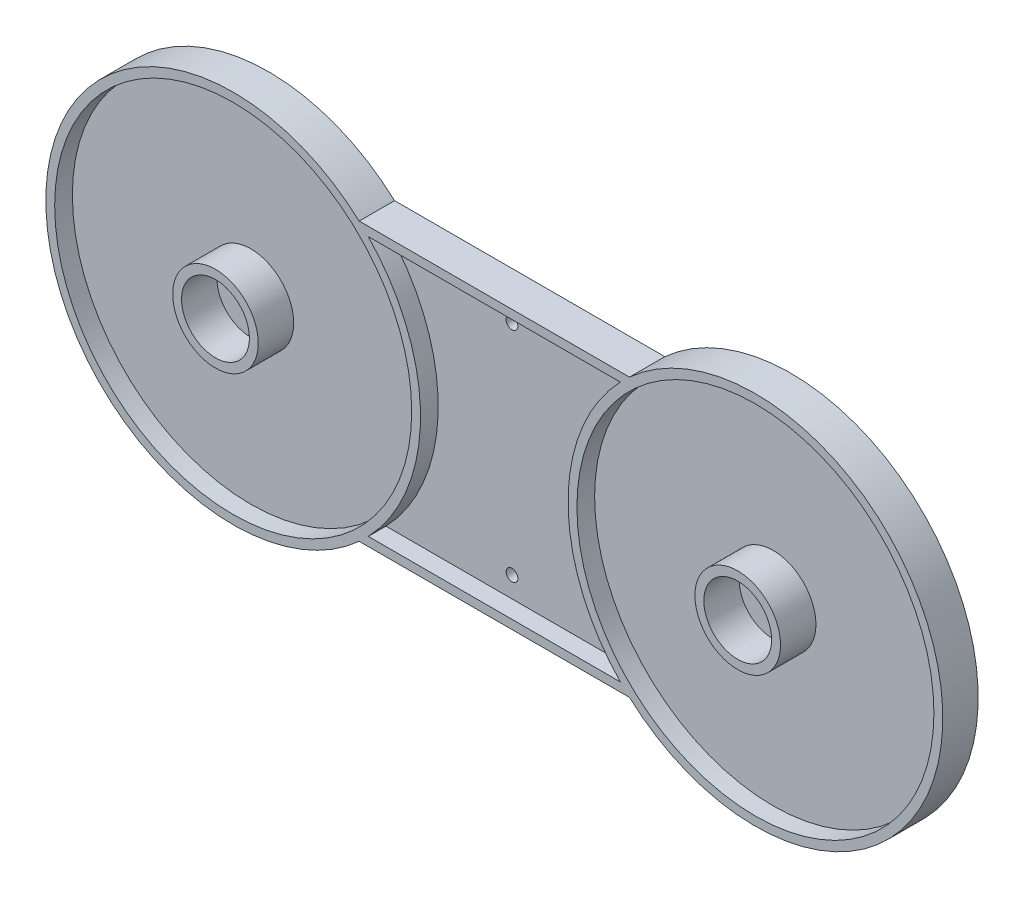
from build123d import *
from build123d.topology import SkipClean

# Parameters (mm, degrees)
IZIM2_R                     = 1
Y_KSEKLIK_EKSTR_ZYON1_DEPTH = 3
IZIM3_R                     = 30.25
Y_KSEKLIK_EKSTR_ZYON2_DEPTH = 3
IZIM4_R                     = 7.25
IZIM4_R_2                   = 5.75
Y_KSEKLIK_EKSTR_ZYON3_DEPTH = 6


with BuildPart() as part:
    # Çizim2 → Yükseklik-Ekstrüzyon1 (new body)
    with BuildSketch(Plane.XY):
        with BuildLine():
            Line((-22.900234193, 23.5), (22.900234193, 23.5))
            ThreePointArc((22.900234193, 23.5), (76, 0), (22.900234193, -23.5))
            Line((22.900234193, -23.5), (-22.900234193, -23.5))
            ThreePointArc((-22.900234193, -23.5), (-76, 0), (-22.900234193, 23.5))
        make_face()
        with Locations((0, -18.5)):
            Circle(IZIM2_R, mode=Mode.SUBTRACT)
        with Locations(Location((0, 18.5, 0), (0, 0, 180))):
            Circle(IZIM2_R, mode=Mode.SUBTRACT)
    extrude(amount=Y_KSEKLIK_EKSTR_ZYON1_DEPTH)

    # Çizim3 → Yükseklik-Ekstrüzyon2 (add)
    # profile 1 of 4: a face of its own
    with SkipClean():  # the faces are left unmerged after this step: merging them gives an invalid solid
        with BuildSketch(Plane.XY.offset(3)):
            with BuildLine():
                ThreePointArc((-22.900234193, 23.5), (-76, 0), (-22.900234193, -23.5))
                ThreePointArc((-22.900234193, -23.5), (-22.116200933, -22.763071824), (-21.357588594, -22))
                ThreePointArc((-21.357588594, -22), (-14.797525043, -11.858086647), (-12.5, 0))
                ThreePointArc((-12.5, 0), (-14.797525043, 11.858086647), (-21.357588594, 22))
                ThreePointArc((-21.357588594, 22), (-22.116200933, 22.763071824), (-22.900234193, 23.5))
            make_face()
            with Locations((-44.25, 0)):
                Circle(IZIM3_R, mode=Mode.SUBTRACT)
        # profile 2 of 4: a face of its own
        with BuildSketch(Plane.XY.offset(3)):
            with BuildLine():
                ThreePointArc((21.357588594, -22), (22.116200933, -22.763071824), (22.900234193, -23.5))
                ThreePointArc((22.900234193, -23.5), (57.099269155, -29.033752465), (76, 0))
                ThreePointArc((76, 0), (57.099269155, 29.033752465), (22.900234193, 23.5))
                ThreePointArc((22.900234193, 23.5), (22.116200933, 22.763071824), (21.357588594, 22))
                ThreePointArc((21.357588594, 22), (12.5, 0), (21.357588594, -22))
            make_face()
            with Locations((44.25, 0)):
                Circle(IZIM3_R, mode=Mode.SUBTRACT)
        # profile 3 of 4: a face of its own
        with BuildSketch(Plane.XY.offset(3)):
            with BuildLine():
                ThreePointArc((-21.357588594, -22), (-22.116200933, -22.763071824), (-22.900234193, -23.5))
                Line((-22.900234193, -23.5), (22.900234193, -23.5))
                ThreePointArc((22.900234193, -23.5), (22.116200933, -22.763071824), (21.357588594, -22))
                Line((21.357588594, -22), (-21.357588594, -22))
            make_face()
        # profile 4 of 4: a face of its own
        with BuildSketch(Plane.XY.offset(3)):
            with BuildLine():
                Line((22.900234193, 23.5), (-22.900234193, 23.5))
                ThreePointArc((-22.900234193, 23.5), (-22.116200933, 22.763071824), (-21.357588594, 22))
                Line((-21.357588594, 22), (21.357588594, 22))
                ThreePointArc((21.357588594, 22), (22.116200933, 22.763071824), (22.900234193, 23.5))
            make_face()
        extrude(amount=Y_KSEKLIK_EKSTR_ZYON2_DEPTH)

    # Çizim4 → Yükseklik-Ekstrüzyon3 (add)
    # profile 1 of 2: a face of its own
    with SkipClean():  # the faces are left unmerged after this step: merging them gives an invalid solid
        with BuildSketch(Plane.XY.offset(3)):
            with Locations((-44.25, 0)):
                Circle(IZIM4_R)
            with Locations((-44.25, 0)):
                Circle(IZIM4_R_2, mode=Mode.SUBTRACT)
        # profile 2 of 2: a face of its own
        with BuildSketch(Plane.XY.offset(3)):
            with Locations(Location((44.25, 0, 0), (0, 0, 180))):
                Circle(IZIM4_R)
            with Locations(Location((44.25, 0, 0), (0, 0, 180))):
                Circle(IZIM4_R_2, mode=Mode.SUBTRACT)
        extrude(amount=Y_KSEKLIK_EKSTR_ZYON3_DEPTH)


solid = part.part
